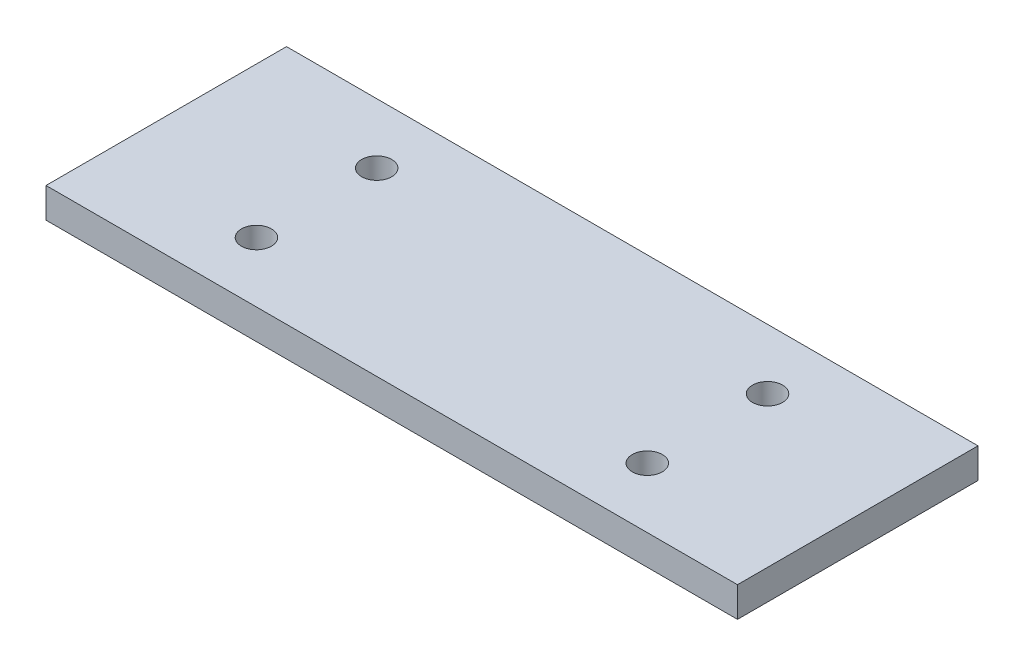
from build123d import *

# Parameters (mm, degrees)
SKETCH1_W           = 115
SKETCH1_H           = 40
SKETCH1_R           = 2.5
BOSS_EXTRUDE1_DEPTH = 2.5


with BuildPart() as part:
    # Sketch1 → Boss-Extrude1 (new, symmetric)
    with BuildSketch(Plane(origin=(0, 0, 0), x_dir=(1, 0, 0), z_dir=(0, 1, 0))):
        Rectangle(SKETCH1_W, SKETCH1_H)
        with Locations(Location((32.5, 10, 0), (0, 0, 270))):
            Circle(SKETCH1_R, mode=Mode.SUBTRACT)
        with Locations(Location((32.5, -10, 0), (0, 0, 90))):
            Circle(SKETCH1_R, mode=Mode.SUBTRACT)
        with Locations(Location((-32.5, -10, 0), (0, 0, 270))):
            Circle(SKETCH1_R, mode=Mode.SUBTRACT)
        with Locations(Location((-32.5, 10, 0), (0, 0, 90))):
            Circle(SKETCH1_R, mode=Mode.SUBTRACT)
    extrude(amount=BOSS_EXTRUDE1_DEPTH, both=True)


solid = part.part
